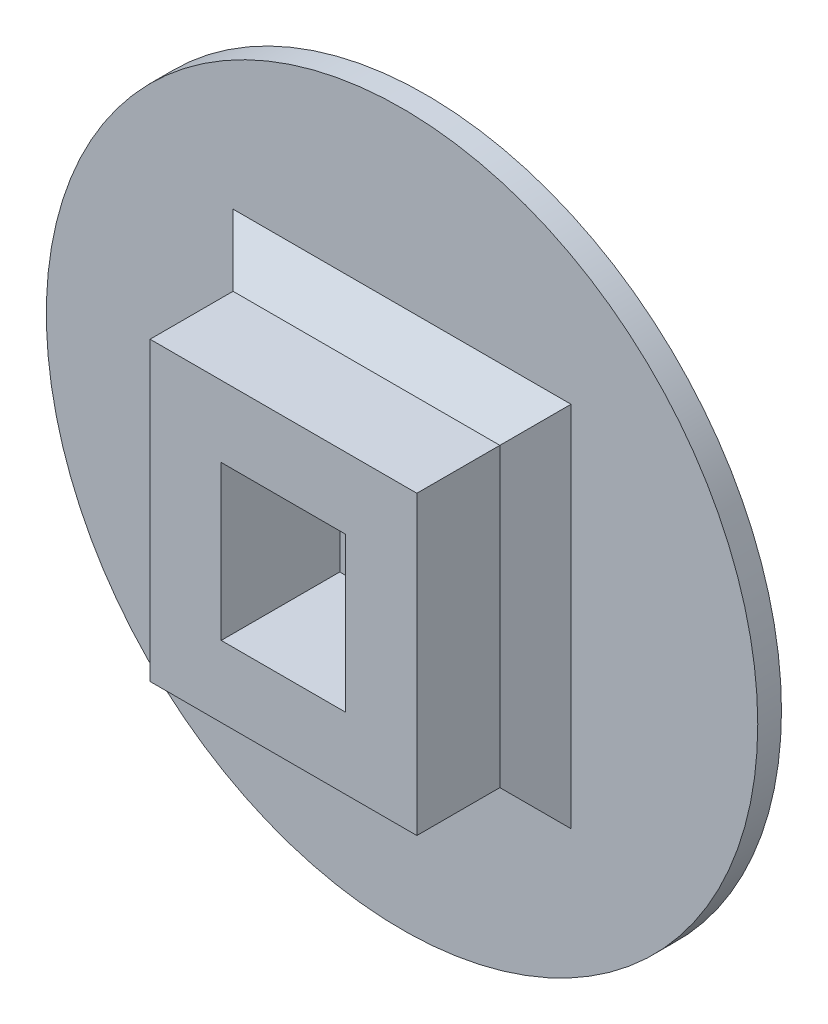
from build123d import *

# Parameters (mm, degrees)
ESQUISSE1_R        = 6
BOSS_EXTRU_1_DEPTH = 0.4
D_ME1_FACE_RADIUS  = 6
D_ME1_HEIGHT       = 1.8
ESQUISSE3_W        = 4.5
ESQUISSE3_H        = 5
ESQUISSE3_W_2      = 2.1
ESQUISSE3_H_2      = 2.6
EXTRU_MINCE1_DEPTH = 2
CHANFREIN1_SIZE    = 0.6


with BuildPart() as part:
    # Esquisse1 → Boss.-Extru.1 (new body)
    with BuildSketch(Plane.XY):
        Circle(ESQUISSE1_R)
    extrude(amount=BOSS_EXTRU_1_DEPTH)

    # Dôme1: a dome of height H over a round flat face of radius A is a cap of a sphere of radius (A * A + H * H) / (2 * H)
    d_me1_r = (D_ME1_FACE_RADIUS * D_ME1_FACE_RADIUS + D_ME1_HEIGHT * D_ME1_HEIGHT) / (2 * D_ME1_HEIGHT)
    d_me1_base = Plane((0, 0, 0), z_dir=(0, 0, -1))
    with Locations(d_me1_base.offset(D_ME1_HEIGHT - d_me1_r)):
        d_me1_ball = Sphere(d_me1_r, mode=Mode.PRIVATE)
    add(split(d_me1_ball, bisect_by=d_me1_base, keep=Keep.TOP, mode=Mode.PRIVATE))

    # Esquisse3 → Extru.-Mince1 (add)
    with BuildSketch(Plane.XY.offset(0.4)):
        Rectangle(ESQUISSE3_W, ESQUISSE3_H)
        Rectangle(ESQUISSE3_W_2, ESQUISSE3_H_2, mode=Mode.SUBTRACT)
    extrude(amount=EXTRU_MINCE1_DEPTH)

    # Chanfrein1
    chanfrein1_edges = [part.edges().sort_by_distance(p)[0] for p in [
        (2.25, 0, 0.4),
        (0, 2.5, 0.4),
        (-2.25, 0, 0.4),
        (0, -2.5, 0.4),
    ]]
    chamfer(chanfrein1_edges, length=CHANFREIN1_SIZE)


solid = part.part
